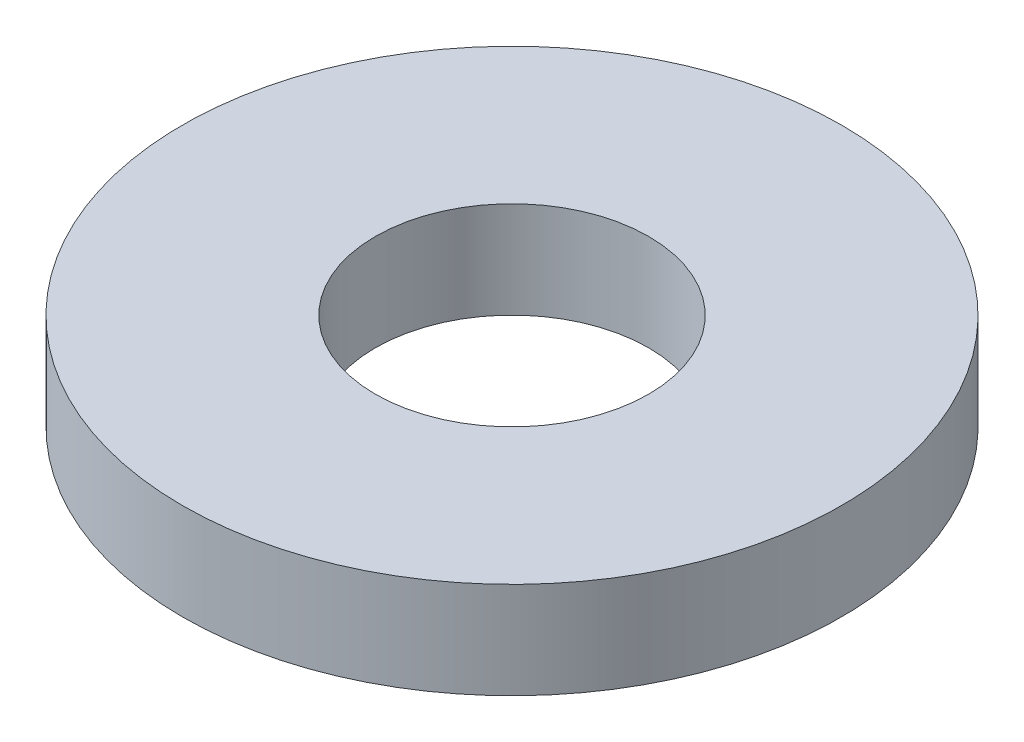
from build123d import *

# Parameters (mm, degrees)
SKETCH1_R           = 5.207
SKETCH1_R_2         = 2.159
BOSS_EXTRUDE1_DEPTH = 1.524


with BuildPart() as part:
    # Sketch1 → Boss-Extrude1 (new body)
    with BuildSketch(Plane(origin=(0, 0, 0), x_dir=(1, 0, 0), z_dir=(0, 1, 0))):
        with Locations(Location((0, 0, 0), (0, 0, 90))):
            Circle(SKETCH1_R)
        with Locations(Location((0, 0, 0), (0, 0, 90))):
            Circle(SKETCH1_R_2, mode=Mode.SUBTRACT)
    extrude(amount=BOSS_EXTRUDE1_DEPTH)


solid = part.part
